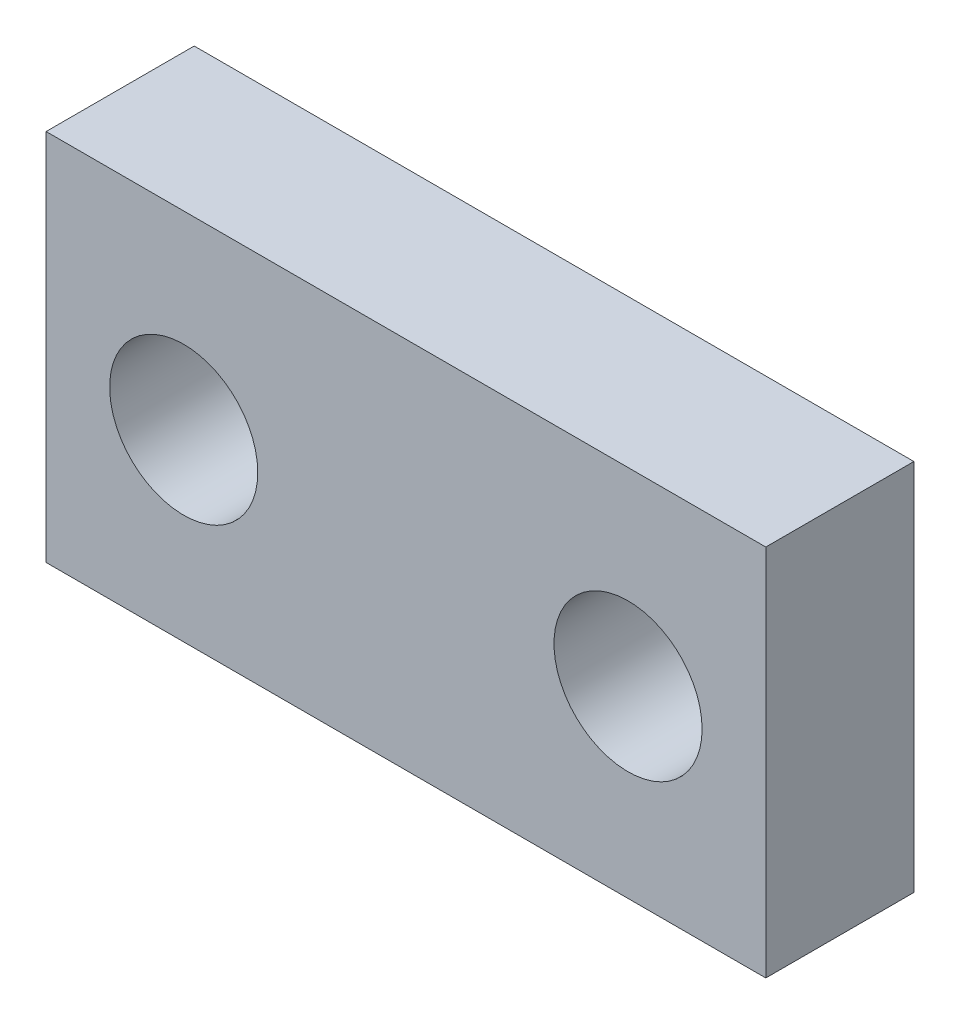
from build123d import *

# Parameters (mm, degrees)
ESQUISSE1_W        = 24.295248989
ESQUISSE1_H        = 12.6
ESQUISSE1_R        = 2.5
BOSS_EXTRU_1_DEPTH = 5


with BuildPart() as part:
    # Esquisse1 → Boss.-Extru.1 (new body)
    with BuildSketch(Plane.XY):
        with Locations((13.342229278, -5.172780833)):
            Rectangle(ESQUISSE1_W, ESQUISSE1_H)
        with Locations((20.839853773, -5.269642607)):
            Circle(ESQUISSE1_R, mode=Mode.SUBTRACT)
        with Locations((5.839853773, -5.269642607)):
            Circle(ESQUISSE1_R, mode=Mode.SUBTRACT)
    extrude(amount=BOSS_EXTRU_1_DEPTH)


solid = part.part
